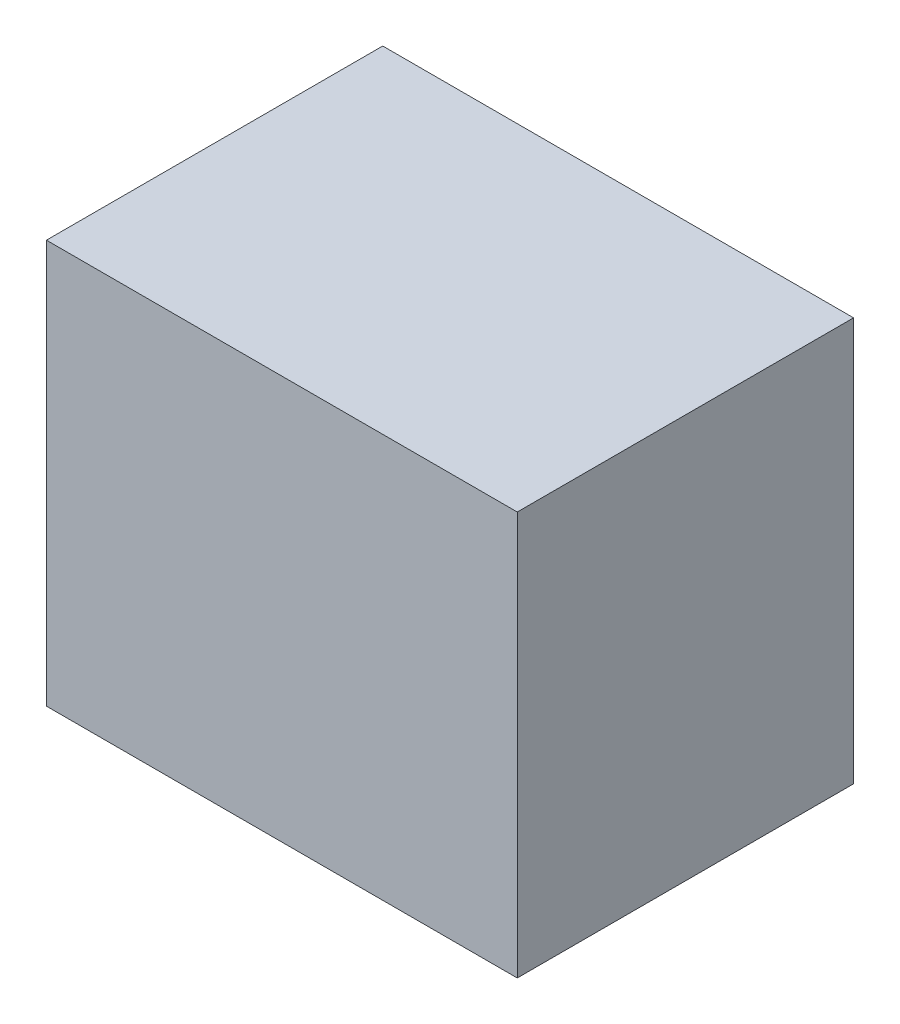
from build123d import *

# Parameters (mm, degrees)
SKETCH_1_W      = 70
SKETCH_1_H      = 60
EXTRUDE_1_DEPTH = 50


with BuildPart() as part:
    # 草图1 → 凸台-拉伸1 (new body)
    with BuildSketch(Plane.XY):
        Rectangle(SKETCH_1_W, SKETCH_1_H)
    extrude(amount=EXTRUDE_1_DEPTH)


solid = part.part
